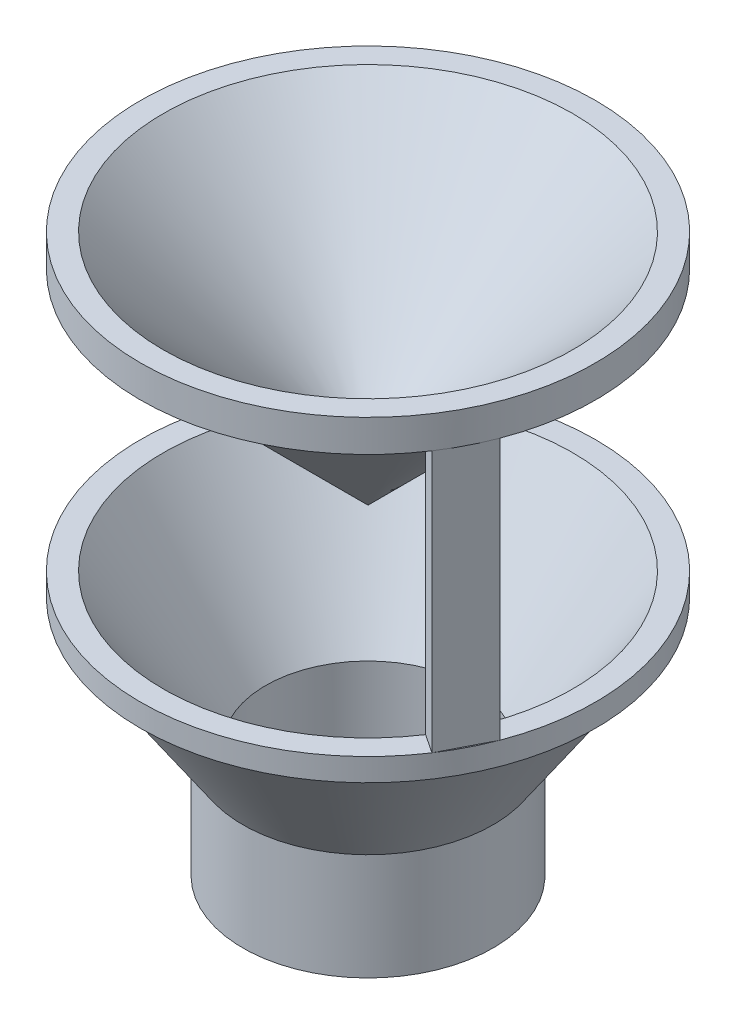
from build123d import *

# Parameters (mm, degrees)
BOSS_EXTRUDE2_DEPTH = 23


with BuildPart() as part:
    # Sketch1 → Revolve-Thin3 (revolve)
    with BuildSketch(Plane.XY, mode=Mode.PRIVATE) as revolve_thin3_sk:
        Polygon((-20, 13.228756555), (-18, 13.228756555), (-9, 0), (-9, -10), (-11, -10), (-11, -0.615831877), (-19.058300524, 11.228756555), (-20, 11.228756555), align=None)
    revolve(revolve_thin3_sk.sketch.rotate(Axis((0, 0, 0), (0, 1, 0)), 270), axis=Axis((0, 0, 0), (0, 1, 0)))



with BuildPart() as body_2:
    # Sketch7 → Revolve2 (revolve)
    with BuildSketch(Plane.XY, mode=Mode.PRIVATE) as revolve2_sk:
        Polygon((0, 18.228756555), (18, 36.228756555), (20, 36.228756555), (20, 39.05718368), (18, 39.05718368), (0, 21.05718368), align=None)
    revolve(revolve2_sk.sketch.rotate(Axis((0, 0, 0), (0, 1, 0)), 270), axis=Axis((0, 0, 0), (0, 1, 0)))


with BuildPart() as part_1:
    add(part.part)

    add(body_2.part)  # Boss-Extrude2 merges body 2
    # Sketch8 → Boss-Extrude2 (add)
    with BuildSketch(Plane.XZ.offset(-36.228756555)):
        Polygon((-16.024377741, -8.198738805), (-16.898983319, -6.198738805), (-18.776648132, -6.887487561), (-16.684330841, -11.028739927), (-15.015897757, -9.925865935), align=None)
        Polygon((16.015573595, 8.215923712), (15.005241471, 9.941968034), (16.672490524, 11.046631149), (18.697980652, 7.098275814), (16.828182587, 6.388448233), align=None)
    extrude(amount=BOSS_EXTRUDE2_DEPTH)


solid = part_1.part
